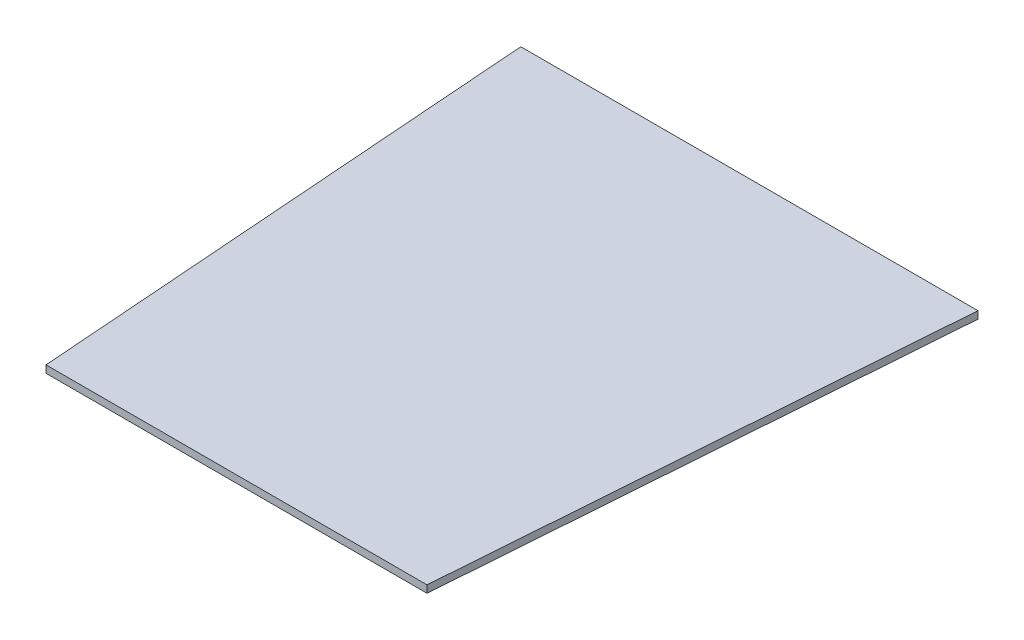
from build123d import *

# Parameters (mm, degrees)
SKETCH1_W           = 312
SKETCH1_H           = 350
BOSS_EXTRUDE1_DEPTH = 5
CUT_EXTRUDE1_DEPTH  = 235.490937991


with BuildPart() as part:
    # Sketch1 → Boss-Extrude1 (new body)
    with BuildSketch(Plane(origin=(0, 0, 0), x_dir=(1, 0, 0), z_dir=(0, 1, 0))):
        Rectangle(SKETCH1_W, SKETCH1_H)
    extrude(amount=BOSS_EXTRUDE1_DEPTH)

    # Sketch3 → Cut-Extrude1 (cut, through all)
    with BuildSketch(Plane(origin=(0, 5, 0), x_dir=(1, 0, 0), z_dir=(0, 1, 0))):
        Polygon((156, -175), (156, 175), (130, -175), align=None)
        Polygon((-130, -175), (-156, 175), (-156, -175), align=None)
    extrude(amount=-CUT_EXTRUDE1_DEPTH, mode=Mode.SUBTRACT)


solid = part.part
